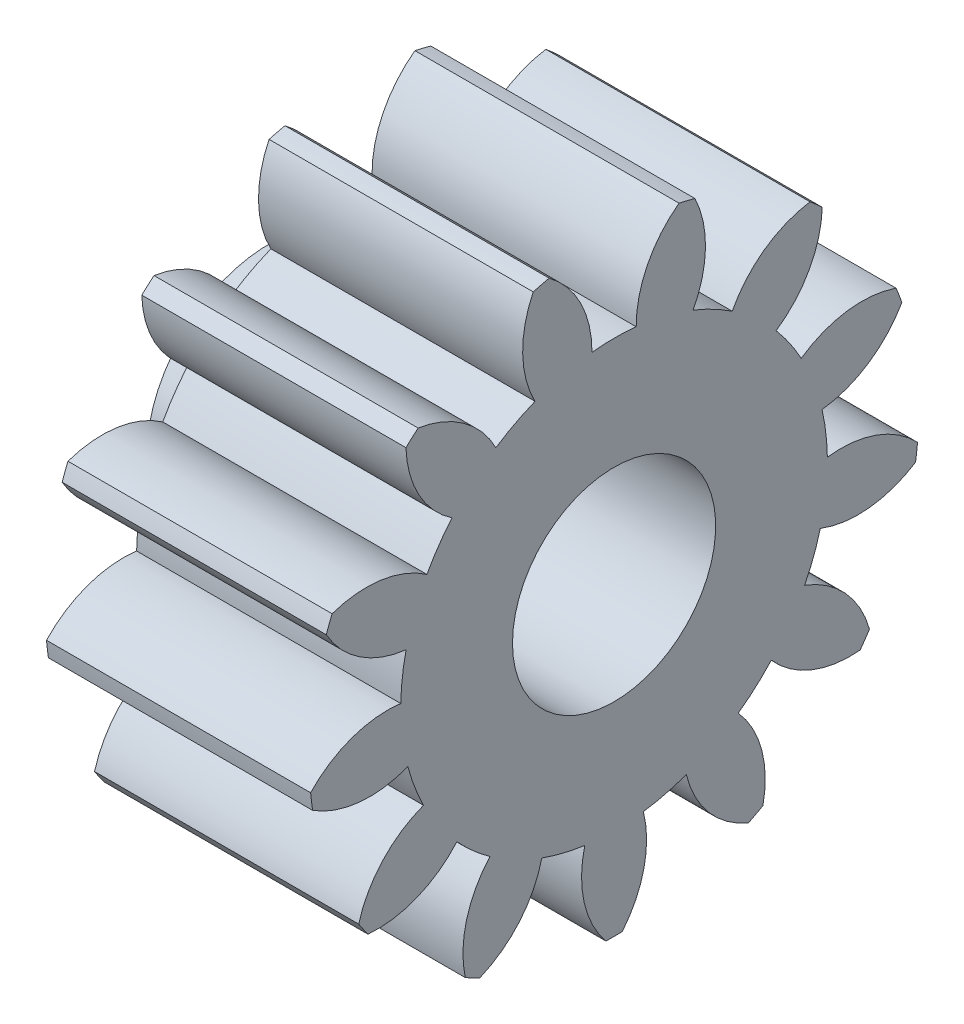
from build123d import *

# Parameters (mm, degrees)
BASPROSKE_W      = 13
BASPROSKE_H      = 15
TOOTHCUT_DEPTH   = 25.879710609
TEETHCUTS_COUNT  = 13
TEETHCUTS_ANGLE  = 332.307692308
HUBNEAONESKE_R   = 6
HUBNEARONE_DEPTH = 4.0000508
BORSKE_R         = 5
BORE_DEPTH       = 17.0000508
SCALE1_SCALE     = 0.317565217


with BuildPart() as part:
    # BasProSke → Base-Revolve (revolve)
    with BuildSketch(Plane(origin=(0, 0, 0), x_dir=(1, 0, 0), z_dir=(0, 1, 0)), mode=Mode.PRIVATE) as base_revolve_sk:
        with Locations((6.5, 7.5)):
            Rectangle(BASPROSKE_W, BASPROSKE_H)
    revolve(base_revolve_sk.sketch.rotate(Axis((-10, 0, 0), (1, 0, 0)), 180), axis=Axis((-10, 0, 0), (1, 0, 0)))

    # TooCutSke → ToothCut (cut, through all)
    with BuildSketch(Plane(origin=(0, 0, 0), x_dir=(0, 0, -1), z_dir=(1, 0, 0))):
        with BuildLine():
            ThreePointArc((1.088245291, 10.442448141), (0, 10.499), (-1.088245291, 10.442448141))
            ThreePointArc((-1.088245291, 10.442448141), (-1.646045958, 12.816546547), (-3.224884568, 14.675243258))
            ThreePointArc((-3.224884568, 14.675243258), (0, 15.0254), (3.224884568, 14.675243258))
            ThreePointArc((3.224884568, 14.675243258), (1.646045958, 12.816546547), (1.088245291, 10.442448141))
        make_face()
    toothcut = extrude(amount=TOOTHCUT_DEPTH, mode=Mode.SUBTRACT)

    # TeethCuts: ToothCut ×13 about axis
    teethcuts_axis = Axis((-10, 0, 0), (1, 0, 0))
    for i in range(1, TEETHCUTS_COUNT):
        add(toothcut.rotate(teethcuts_axis, i * TEETHCUTS_ANGLE / (TEETHCUTS_COUNT - 1)), mode=Mode.SUBTRACT)

    # HubNeaOneSke → HubNearOne (add)
    with BuildSketch(Plane.ZY):
        with Locations(Location((0, 0, 0), (0, 0, 180))):
            Circle(HUBNEAONESKE_R)
    extrude(amount=HUBNEARONE_DEPTH)

    # BorSke → Bore (cut, symmetric)
    with BuildSketch(Plane(origin=(0, 0, 0), x_dir=(0, 0, -1), z_dir=(1, 0, 0))):
        with Locations(Location((0, 0, 0), (0, 0, 180))):
            Circle(BORSKE_R)
    extrude(amount=BORE_DEPTH, both=True, mode=Mode.SUBTRACT)


with BuildPart() as part_1:
    # Scale1: scaled about (6.291140597, 0, 0)
    add(part.part.scale(SCALE1_SCALE).moved(Location((4.293293168, 0, 0))))


solid = part_1.part
